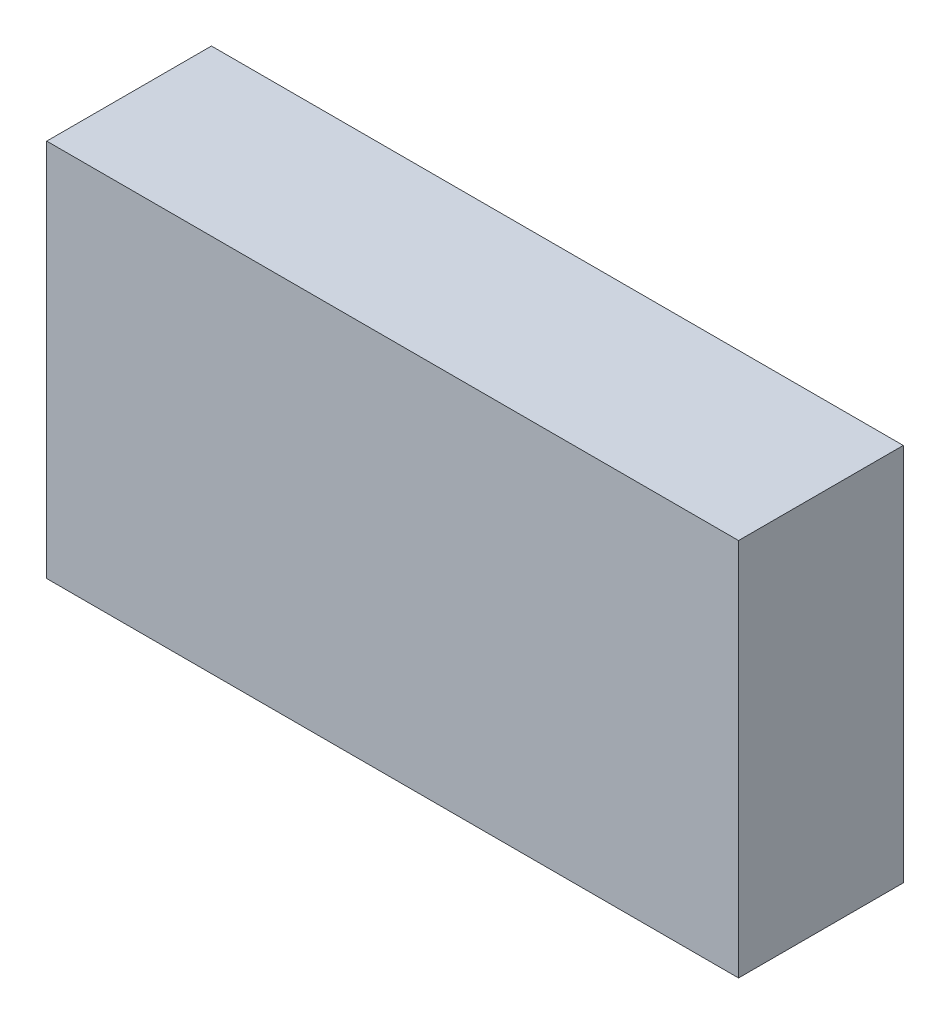
from build123d import *

# Parameters (mm, degrees)
ESQUISSE1_W        = 210
ESQUISSE1_H        = 115
BOSS_EXTRU_1_DEPTH = 50


with BuildPart() as part:
    # Esquisse1 → Boss.-Extru.1 (new body)
    with BuildSketch(Plane.XY):
        with Locations((10.085864001, -19.352517986)):
            Rectangle(ESQUISSE1_W, ESQUISSE1_H)
    extrude(amount=BOSS_EXTRU_1_DEPTH)


solid = part.part
